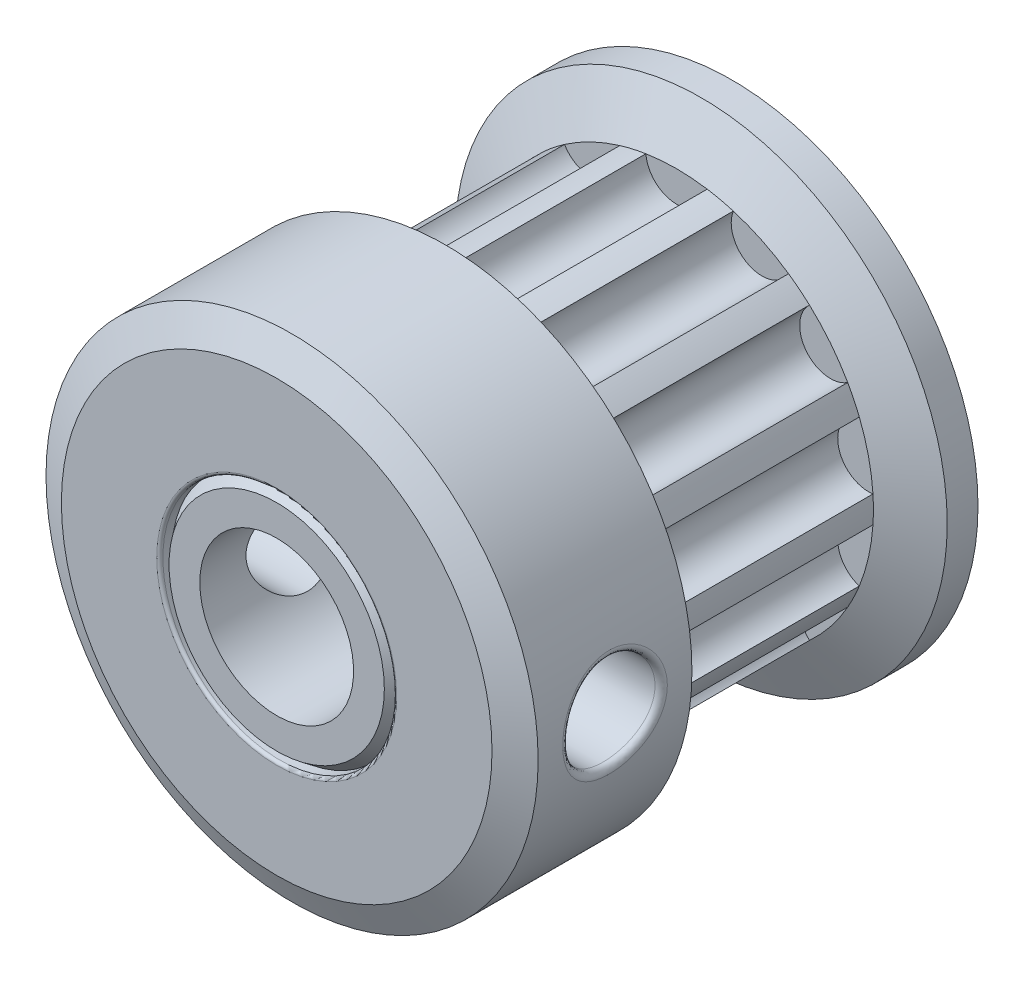
from build123d import *

# Parameters (mm, degrees)
ESBO_O2_R                  = 2.5
CORTE_EXTRUS_O1_DEPTH      = 19.629009636
ESBO_O4_R                  = 1
CORTE_EXTRUS_O2_DEPTH      = 7
CORTE_EXTRUS_O3_DEPTH      = 19.629009636
CORTE_EXTRUS_O3_DEPTH_BACK = 19.629009636
ESBO_O5_R                  = 1.5
FILETE1_R                  = 0.2


with BuildPart() as part:
    # Esboço1 → Revolução1 (revolve)
    with BuildSketch(Plane(origin=(0, 0, 0), x_dir=(0, 0, -1), z_dir=(1, 0, 0)), mode=Mode.PRIVATE) as revolu_o1_sk:
        with BuildLine():
            Line((0, 7), (0, 3.9))
            ThreePointArc((0, 3.9), (0.029289322, 3.829289322), (0.1, 3.8))
            Line((0.1, 3.8), (0.4, 3.8))
            Line((0.4, 3.8), (0, 3.5))
            Line((0, 3.5), (0, 0))
            Line((0, 0), (14.8, 0))
            Line((14.8, 0), (14.8, 3.854253969))
            Line((14.8, 3.854253969), (14.3, 4.354253969))
            Line((14.3, 4.354253969), (13.977126984, 4.354253969))
            Line((13.977126984, 4.354253969), (13.977126984, 6.354253969))
            Line((13.977126984, 6.354253969), (14.8, 8))
            Line((14.8, 8), (13.8, 8))
            Line((13.8, 8), (13, 6.4))
            Line((13, 6.4), (6, 6.4))
            Line((6, 6.4), (6, 7))
            Line((6, 7), (5.5, 8))
            Line((5.5, 8), (0.5, 8))
            Line((0.5, 8), (0, 7))
        make_face()
    revolve(revolu_o1_sk.sketch.rotate(Axis((0, 0, 0), (0, 0, -1)), 90), axis=Axis((0, 0, 0), (0, 0, -1)))

    # Esboço2 → Corte-extrusão1 (cut, through all)
    with BuildSketch(Plane(origin=(0, 0, -14.8), x_dir=(-1, 0, 0), z_dir=(0, 0, -1))):
        Circle(ESBO_O2_R)
    extrude(amount=-CORTE_EXTRUS_O1_DEPTH, mode=Mode.SUBTRACT)

    # Esboço4 → Corte-extrusão2 (cut)
    with BuildSketch(Plane(origin=(0, 0, -6), x_dir=(-1, 0, 0), z_dir=(0, 0, -1))):
        with Locations((0, 6.4)):
            Circle(ESBO_O4_R)
        with Locations((2.77685593, 5.766200755)):
            Circle(ESBO_O4_R)
        with Locations((5.003721488, 3.990334732)):
            Circle(ESBO_O4_R)
        with Locations((6.239538638, 1.424133977)):
            Circle(ESBO_O4_R)
        with Locations((6.239538638, -1.424133977)):
            Circle(ESBO_O4_R)
        with Locations((5.003721488, -3.990334732)):
            Circle(ESBO_O4_R)
        with Locations((2.77685593, -5.766200755)):
            Circle(ESBO_O4_R)
        with Locations((0, -6.4)):
            Circle(ESBO_O4_R)
        with Locations((-2.77685593, -5.766200755)):
            Circle(ESBO_O4_R)
        with Locations((-5.003721488, -3.990334732)):
            Circle(ESBO_O4_R)
        with Locations((-6.239538638, -1.424133977)):
            Circle(ESBO_O4_R)
        with Locations((-6.239538638, 1.424133977)):
            Circle(ESBO_O4_R)
        with Locations((-5.003721488, 3.990334732)):
            Circle(ESBO_O4_R)
        with Locations((-2.77685593, 5.766200755)):
            Circle(ESBO_O4_R)
    extrude(amount=CORTE_EXTRUS_O2_DEPTH, mode=Mode.SUBTRACT)

    # Esboço5 → Corte-extrusão3 (cut, two sides: drawn at the far end of the back side and taken through both)
    with BuildSketch(Plane(origin=(0, 0, 0), x_dir=(0, 0, -1), z_dir=(1, 0, 0)).offset(-CORTE_EXTRUS_O3_DEPTH_BACK)):
        with Locations(Location((3, 0, 0), (0, 0, 180))):
            Circle(ESBO_O5_R)
    extrude(amount=CORTE_EXTRUS_O3_DEPTH + CORTE_EXTRUS_O3_DEPTH_BACK, mode=Mode.SUBTRACT)

    # Filete1
    filete1_edges = [part.edges().sort_by_distance(p)[0] for p in [
        (7.858116823, 1.5, -3),
        (-8, 0, -4.5),
    ]]
    fillet(filete1_edges, radius=FILETE1_R)


solid = part.part
